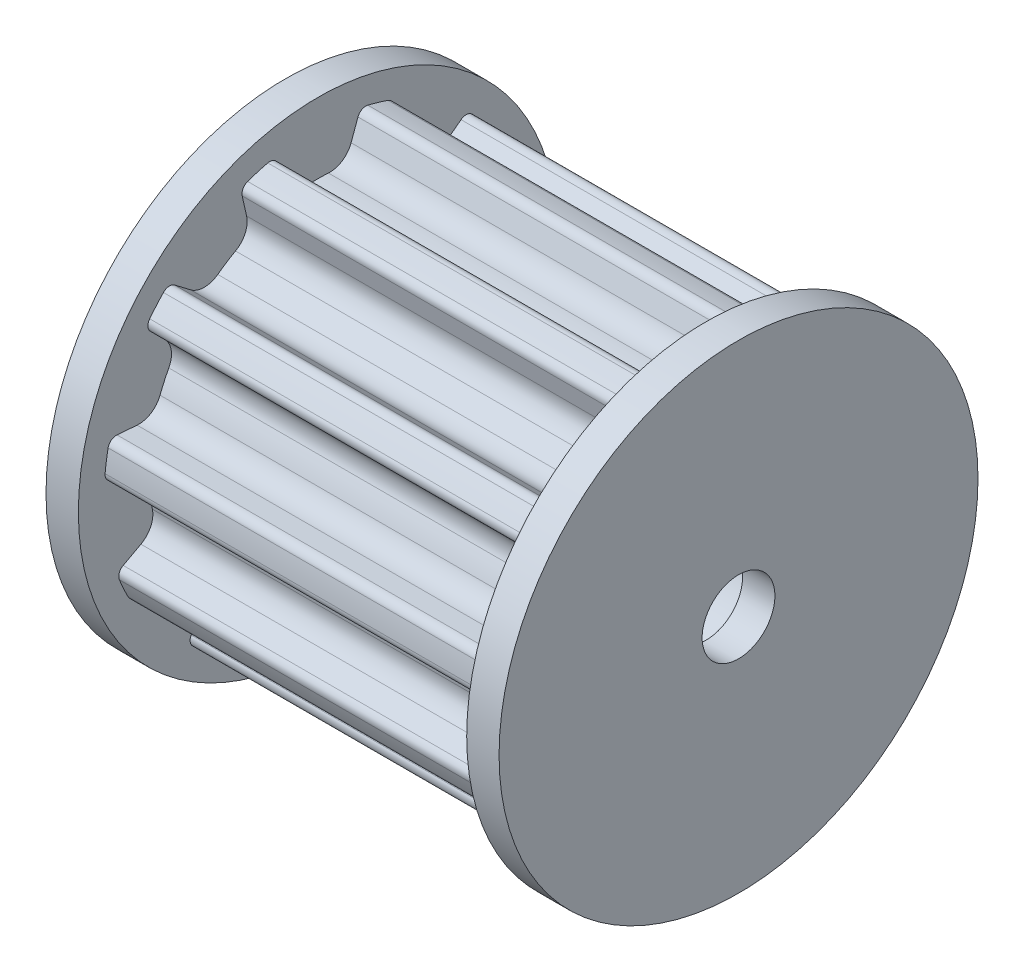
from build123d import *

# Parameters (mm, degrees)
CUT_EXTRUDE_2_REACH      = 9.602
PATTERN_CIRCULAR_3_COUNT = 11
SKETCH_7_R               = 3.7
EXTRUDE_1_DEPTH          = 0.5
SKETCH_8_R               = 1.75
CUT_EXTRUDE_3_DEPTH      = 0.25
EXTRUDE_START            = 0.5
SKETCH_9_R               = 3.7
EXTRUDE_2_DEPTH          = 0.5
SKETCH_11_R              = 1.55
CUT_EXTRUDE_5_DEPTH      = 3
SKETCH_13_R              = 0.5625
CUT_EXTRUDE_7_DEPTH      = 9.739565207


with BuildPart() as part:
    # 草图1 → 旋转1 (revolve)
    with BuildSketch(Plane.XY):
        Polygon((0, 1), (0, 3.301), (6, 3.301), (6, 2.2264), (6, 1), align=None)
    revolve(axis=Axis((0, 0, 0), (1, 0, 0)))

    # 草图6 → 切除-拉伸2 (cut, up to next)
    with BuildSketch(Plane(origin=(0, 0, 0), x_dir=(0, 0, -1), z_dir=(1, 0, 0)), mode=Mode.PRIVATE) as cut_extrude_2_sk1:
        with BuildLine():
            Line((0.620299767, 3.127317535), (0.514085384, 2.835495915))
            ThreePointArc((0.514085384, 2.835495915), (0.376876254, 2.662359121), (0.163302545, 2.605888194))
            ThreePointArc((0.163302545, 2.605888194), (0, 2.611), (-0.163302545, 2.605888194))
            ThreePointArc((-0.163302545, 2.605888194), (-0.376876254, 2.662359121), (-0.514085384, 2.835495915))
            Line((-0.514085384, 2.835495915), (-0.620299767, 3.127317535))
            ThreePointArc((-0.620299767, 3.127317535), (-0.680969197, 3.197392704), (-0.772898084, 3.209241273))
            ThreePointArc((-0.772898084, 3.209241273), (-0.835941408, 3.193399906), (-0.898660577, 3.176320224))
            Line((-0.898660577, 3.176320224), (-1.396756451, 4.544827391))
            ThreePointArc((-1.396756451, 4.544827391), (0, 4.754617188), (1.396756451, 4.544827391))
            Line((1.396756451, 4.544827391), (0.898660577, 3.176320224))
            ThreePointArc((0.898660577, 3.176320224), (0.835941408, 3.193399906), (0.772898084, 3.209241273))
            ThreePointArc((0.772898084, 3.209241273), (0.680969197, 3.197392704), (0.620299767, 3.127317535))
        make_face()
    cut_extrude_2_tool1 = extrude(cut_extrude_2_sk1.sketch, amount=CUT_EXTRUDE_2_REACH, mode=Mode.PRIVATE) & part.part
    cut_extrude_2 = cut_extrude_2_tool1.solids().sort_by_distance((0, 3.839085, 0))[0]
    add(cut_extrude_2, mode=Mode.SUBTRACT)

    # 阵列(圆周)3: 切除-拉伸2 ×11 about axis
    pattern_circular_3_axis = Axis((-72.503953235, 0, 0), (1, 0, 0))
    for i in range(1, PATTERN_CIRCULAR_3_COUNT):
        add(cut_extrude_2.rotate(pattern_circular_3_axis, i * 360 / PATTERN_CIRCULAR_3_COUNT), mode=Mode.SUBTRACT)

    # 草图7 → 凸台-拉伸1 (add)
    with BuildSketch(Plane.ZY):
        Circle(SKETCH_7_R)
    extrude(amount=EXTRUDE_1_DEPTH)

    # 草图8 → 切除-拉伸3 (cut)
    with BuildSketch(Plane.ZY.offset(0.5)):
        Circle(SKETCH_8_R)
    extrude(amount=-CUT_EXTRUDE_3_DEPTH, mode=Mode.SUBTRACT)

    # 草图9 → 凸台-拉伸2 (add)
    with BuildSketch(Plane(origin=(6, 0, 0), x_dir=(0, 0, -1), z_dir=(1, 0, 0)).offset(EXTRUDE_START)):
        Circle(SKETCH_9_R)
    extrude(amount=-EXTRUDE_2_DEPTH)

    # 草图11 → 切除-拉伸5 (cut)
    with BuildSketch(Plane.ZY.offset(0.25)):
        Circle(SKETCH_11_R)
    extrude(amount=-CUT_EXTRUDE_5_DEPTH, mode=Mode.SUBTRACT)

    # 草图13 → 切除-拉伸7 (cut, through all)
    with BuildSketch(Plane(origin=(6.5, 0, 0), x_dir=(0, 0, -1), z_dir=(1, 0, 0))):
        Circle(SKETCH_13_R)
    extrude(amount=-CUT_EXTRUDE_7_DEPTH, mode=Mode.SUBTRACT)


solid = part.part
